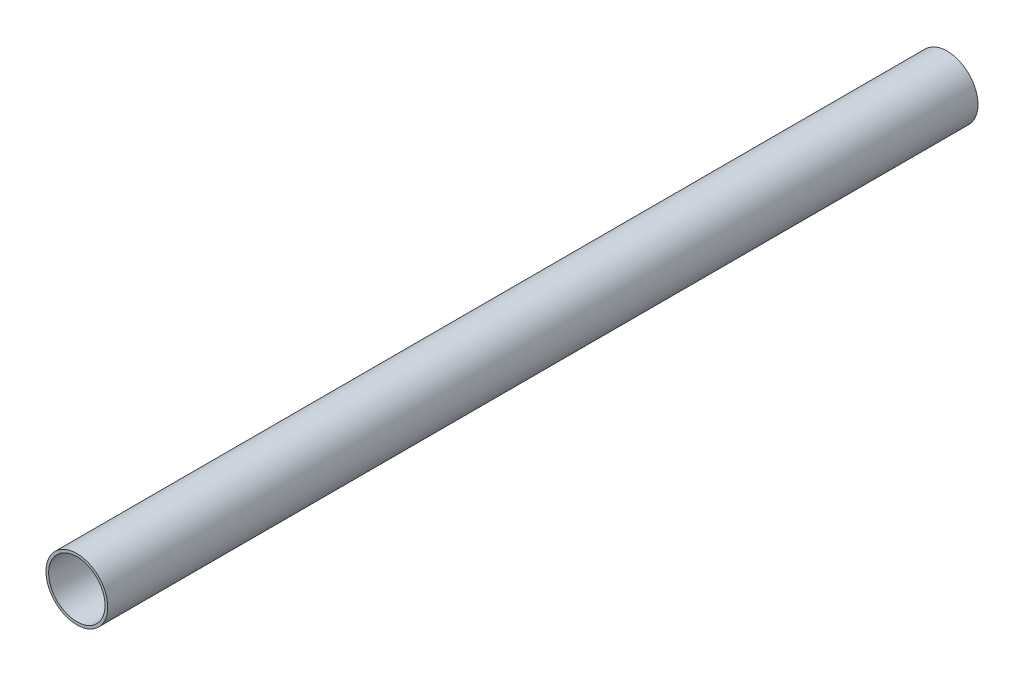
from build123d import *

# Parameters (mm, degrees)
SKETCH1_R           = 15.9385
SKETCH1_R_2         = 14.5415
BOSS_EXTRUDE1_DEPTH = 448.945


with BuildPart() as part:
    # Sketch1 → Boss-Extrude1 (new body)
    with BuildSketch(Plane.XY):
        Circle(SKETCH1_R)
        Circle(SKETCH1_R_2, mode=Mode.SUBTRACT)
    extrude(amount=BOSS_EXTRUDE1_DEPTH)


solid = part.part
